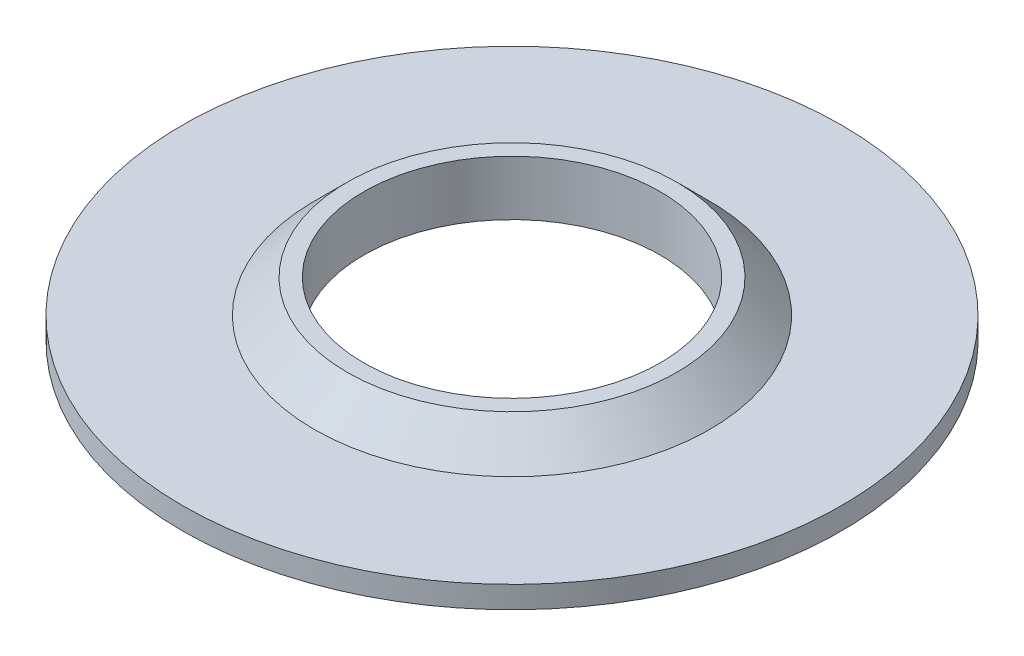
from build123d import *


with BuildPart() as part:
    # Эскиз3 → Повернуть1 (revolve)
    with BuildSketch(Plane(origin=(0, 0, 0), x_dir=(0, 0, -1), z_dir=(1, 0, 0)), mode=Mode.PRIVATE) as revolve_1_sk:
        Polygon((13.5, 0), (30, 0), (30, 2), (18, 2), (15, 5), (13.5, 5), align=None)
    revolve(revolve_1_sk.sketch.rotate(Axis((0, 17.013363668, 0), (0, -1, 0)), 180), axis=Axis((0, 17.013363668, 0), (0, -1, 0)))


solid = part.part
